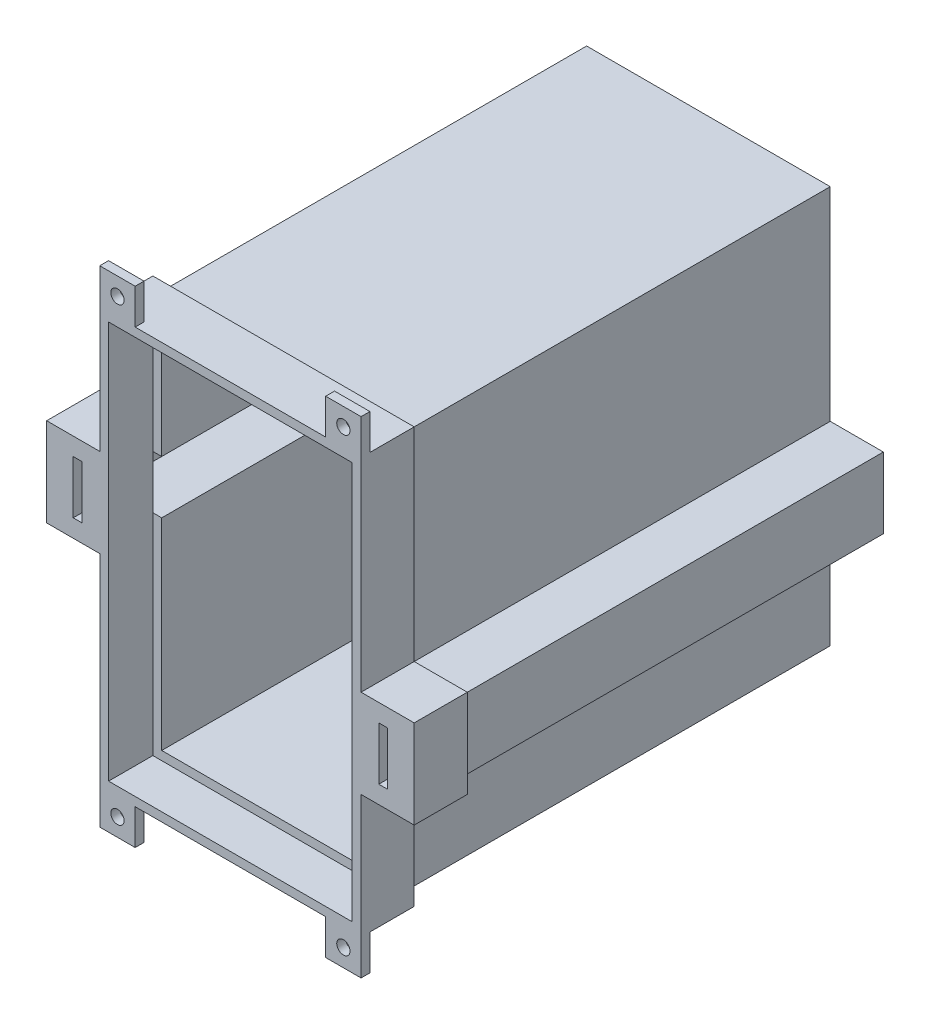
from build123d import *

# Parameters (mm, degrees)
BOSS_EXTRUDE1_DEPTH     = 155.575
SHELL1_T                = -3.175
SKETCH2_W               = 19.05
SKETCH2_H               = 72.263
SKETCH2_H_2             = 44.958
BOSS_EXTRUDE2_DEPTH     = 3.175
SKETCH5_W               = 90.551
SKETCH5_H               = 19.05
BOSS_EXTRUDE8_DEPTH     = 3.175
SKETCH7_W               = 19.05
SKETCH7_H               = 47.498
ALL_6_DEPTH             = 3.175
SKETCH8_W               = 19.05
SKETCH8_H               = 72.898
ALL_5_DEPTH             = 3.175
SKETCH9_W               = 93.726
SKETCH9_H               = 19.05
BOSS_EXTRUDE12_DEPTH    = 3.175
SKETCH10_W              = 15.875
SKETCH10_H              = 19.05
ALL2_DEPTH              = 3.175
SKETCH11_W              = 15.875
SKETCH11_H              = 19.05
ALL_7_DEPTH             = 3.175
SKETCH13_W              = 19.05
SKETCH13_H              = 25.4
ALL_2_DEPTH             = 3.175
SKETCH27_W              = 12.7
SKETCH27_H              = 3.175
BOSS_EXTRUDE29_DEPTH    = 12.7
SKETCH28_R              = 2.38125
CUT_EXTRUDE4_DEPTH      = 227.835119161
MIRROR2_COPY_1_SKETCH_W = 12.7
MIRROR2_COPY_1_SKETCH_H = 3.175
MIRROR2_COPY_1_DEPTH    = 12.7
MIRROR2_COPY_2_SKETCH_R = 2.38125
MIRROR2_COPY_2_DEPTH    = 227.835119161
SKETCH31_W              = 15.875
SKETCH31_H              = 22.225
BOSS_EXTRUDE31_DEPTH    = 3.175
SKETCH87_W              = 19.05
SKETCH87_H              = 31.75
ALL3_DEPTH              = 3.175
SKETCH91_W              = 15.875
SKETCH91_H              = 25.4
ALL_4_DEPTH             = 3.175
CUT_EXTRUDE24_DEPTH     = 201.654704914
SKETCH102_W             = 19.05
SKETCH102_H             = 19.05
BOSS_EXTRUDE58_DEPTH    = 3.175
SKETCH103_W             = 19.05
SKETCH103_H             = 19.05
BOSS_EXTRUDE59_DEPTH    = 3.175
SKETCH105_W             = 15.875
SKETCH105_H             = 25.4
BOSS_EXTRUDE65_DEPTH    = 9.525
SKETCH106_W             = 15.875
SKETCH106_H             = 25.4
BOSS_EXTRUDE66_DEPTH    = 9.525
SKETCH107_W             = 15.875
SKETCH107_H             = 25.4
BOSS_EXTRUDE67_DEPTH    = 6.35
SKETCH108_W             = 15.875
SKETCH108_H             = 25.4
BOSS_EXTRUDE68_DEPTH    = 6.35
SKETCH109_W             = 3.175
SKETCH109_H             = 15.875
BOSS_EXTRUDE69_DEPTH    = 3.175
SKETCH110_W             = 3.175
SKETCH110_H             = 15.875
BOSS_EXTRUDE70_DEPTH    = 3.175
SKETCH111_W             = 3.175
SKETCH111_H             = 15.875
BOSS_EXTRUDE71_DEPTH    = 3.175
SKETCH112_W             = 3.175
SKETCH112_H             = 15.875
BOSS_EXTRUDE72_DEPTH    = 3.175


with BuildPart() as part:
    # Sketch1 → Boss-Extrude1 (new body)
    with BuildSketch(Plane.XY):
        Polygon((-43.688, 71.3105), (43.688, 71.3105), (43.688, -1.5875), (62.738, -1.5875), (62.738, -26.9875), (43.688, -26.9875), (43.688, -71.3105), (-43.688, -71.3105), (-43.688, 0.9525), (-62.738, 0.9525), (-62.738, 26.3525), (-43.688, 26.3525), align=None)
    extrude(amount=-BOSS_EXTRUDE1_DEPTH)

    # Shell1
    shell1_openings = [part.faces().sort_by_distance(p)[0] for p in [
        (0, -0.022879475, 0),
    ]]
    offset(amount=SHELL1_T, openings=shell1_openings, kind=Kind.INTERSECTION)

    # Sketch2 → Boss-Extrude2 (add)
    with BuildSketch(Plane.ZY.offset(43.688)):
        with Locations((6.35, -35.179)):
            Rectangle(SKETCH2_W, SKETCH2_H)
        with Locations((6.35, 48.8315)):
            Rectangle(SKETCH2_W, SKETCH2_H_2)
    extrude(amount=BOSS_EXTRUDE2_DEPTH)

    # Sketch5 → Boss-Extrude8 (add)
    with BuildSketch(Plane.XZ.offset(71.3105)):
        with Locations((-1.5875, 6.35)):
            Rectangle(SKETCH5_W, SKETCH5_H)
    extrude(amount=BOSS_EXTRUDE8_DEPTH)

    # Sketch7 → ALL 6 (add)
    with BuildSketch(Plane(origin=(43.688, 0, 0), x_dir=(0, 0, -1), z_dir=(1, 0, 0))):
        with Locations((-6.35, -50.7365)):
            Rectangle(SKETCH7_W, SKETCH7_H)
    extrude(amount=ALL_6_DEPTH)

    # Sketch8 → ALL 5 (add)
    with BuildSketch(Plane(origin=(43.688, 0, 0), x_dir=(0, 0, -1), z_dir=(1, 0, 0))):
        with Locations((-6.35, 34.8615)):
            Rectangle(SKETCH8_W, SKETCH8_H)
    extrude(amount=ALL_5_DEPTH)

    # Sketch9 → Boss-Extrude12 (add)
    with BuildSketch(Plane(origin=(0, 71.3105, 0), x_dir=(1, 0, 0), z_dir=(0, 1, 0))):
        with Locations((0, -6.35)):
            Rectangle(SKETCH9_W, SKETCH9_H)
    extrude(amount=BOSS_EXTRUDE12_DEPTH)

    # Sketch10 → ALL2 (add)
    with BuildSketch(Plane(origin=(0, -1.5875, 0), x_dir=(1, 0, 0), z_dir=(0, 1, 0))):
        with Locations((54.8005, -6.35)):
            Rectangle(SKETCH10_W, SKETCH10_H)
    extrude(amount=ALL2_DEPTH)

    # Sketch11 → ALL 7 (add)
    with BuildSketch(Plane.XZ.offset(26.9875)):
        with Locations((54.8005, 6.35)):
            Rectangle(SKETCH11_W, SKETCH11_H)
    extrude(amount=ALL_7_DEPTH)

    # Sketch13 → ALL 2 (add)
    with BuildSketch(Plane.ZY.offset(62.738)):
        with Locations((6.35, 13.6525)):
            Rectangle(SKETCH13_W, SKETCH13_H)
    extrude(amount=ALL_2_DEPTH)

    # Sketch27 → Boss-Extrude29 (add)
    with BuildSketch(Plane(origin=(0, 74.4855, -58.6105), x_dir=(1, 0, 0), z_dir=(0, -1, 0))):
        with Locations((40.513, 72.898)):
            Rectangle(SKETCH27_W, SKETCH27_H)
    boss_extrude29 = extrude(amount=-BOSS_EXTRUDE29_DEPTH)

    # Sketch28 → Cut-Extrude4 (cut, through all)
    with BuildSketch(Plane(origin=(0, 58.6105, 15.875), x_dir=(1, 0, 0), z_dir=(0, 0, -1))):
        with Locations(Location((40.513, -22.225, 0), (0, 0, 180))):
            Circle(SKETCH28_R)
    cut_extrude4 = extrude(amount=CUT_EXTRUDE4_DEPTH, mode=Mode.SUBTRACT)

    # Mirror1: Boss-Extrude29, Cut-Extrude4 across plane
    add(boss_extrude29.mirror(Plane(origin=(0, 0, 0), x_dir=(0, 0, 1), z_dir=(1, 0, 0))))
    add(cut_extrude4.mirror(Plane(origin=(0, 0, 0), x_dir=(0, 0, 1), z_dir=(1, 0, 0))), mode=Mode.SUBTRACT)

    # Mirror2: Boss-Extrude29, Cut-Extrude4 across plane
    add(boss_extrude29.mirror(Plane.ZX))
    add(cut_extrude4.mirror(Plane.ZX), mode=Mode.SUBTRACT)

    # Mirror2 copy 1 sketch → Mirror2 copy 1 (add)
    with BuildSketch(Plane(origin=(0, -74.4855, -58.6105), x_dir=(-1, 0, 0), z_dir=(0, 1, 0))):
        with Locations((40.513, 72.898)):
            Rectangle(MIRROR2_COPY_1_SKETCH_W, MIRROR2_COPY_1_SKETCH_H)
    extrude(amount=-MIRROR2_COPY_1_DEPTH)

    # Mirror2 copy 2 sketch → Mirror2 copy 2 (cut, through all)
    with BuildSketch(Plane(origin=(0, -58.6105, 15.875), x_dir=(-1, 0, 0), z_dir=(0, 0, -1))):
        with Locations(Location((40.513, -22.225, 0), (0, 0, 180))):
            Circle(MIRROR2_COPY_2_SKETCH_R)
    extrude(amount=MIRROR2_COPY_2_DEPTH, mode=Mode.SUBTRACT)

    # Sketch31 → Boss-Extrude31 (add)
    with BuildSketch(Plane(origin=(-62.738, 0, 0), x_dir=(0, 0, -1), z_dir=(1, 0, 0))):
        with Locations((-7.9375, 15.24)):
            Rectangle(SKETCH31_W, SKETCH31_H)
    extrude(amount=BOSS_EXTRUDE31_DEPTH)

    # Sketch87 → ALL3 (add)
    with BuildSketch(Plane(origin=(62.738, 0, 0), x_dir=(0, 0, -1), z_dir=(1, 0, 0))):
        with Locations((-6.35, -14.2875)):
            Rectangle(SKETCH87_W, SKETCH87_H)
    extrude(amount=ALL3_DEPTH)

    # Sketch91 → ALL 4 (cut)
    with BuildSketch(Plane(origin=(-59.563, 0, 0), x_dir=(0, 0, -1), z_dir=(1, 0, 0))):
        with Locations((-7.9375, 13.6525)):
            Rectangle(SKETCH91_W, SKETCH91_H)
    extrude(amount=-ALL_4_DEPTH, mode=Mode.SUBTRACT)

    # Sketch101 → Cut-Extrude24 (cut, through all)
    with BuildSketch(Plane.XY.offset(-152.4)):
        Polygon((-40.513, -68.1355), (40.513, -68.1355), (40.513, -23.8125), (59.563, -23.8125), (59.563, -4.7625), (40.513, -4.7625), (40.513, 68.1355), (-40.513, 68.1355), (-40.513, 23.1775), (-59.563, 23.1775), (-59.563, 4.1275), (-40.513, 4.1275), align=None)
    extrude(amount=-CUT_EXTRUDE24_DEPTH, mode=Mode.SUBTRACT)

    # Sketch102 → Boss-Extrude58 (add)
    with BuildSketch(Plane(origin=(0, 26.3525, 0), x_dir=(1, 0, 0), z_dir=(0, 1, 0))):
        with Locations((-56.388, -6.35)):
            Rectangle(SKETCH102_W, SKETCH102_H)
    extrude(amount=BOSS_EXTRUDE58_DEPTH)

    # Sketch103 → Boss-Extrude59 (add)
    with BuildSketch(Plane.XZ.offset(-0.9525)):
        with Locations((-56.388, 6.35)):
            Rectangle(SKETCH103_W, SKETCH103_H)
    extrude(amount=BOSS_EXTRUDE59_DEPTH)

    # Sketch105 → Boss-Extrude65 (add)
    with BuildSketch(Plane(origin=(-43.688, 0, 0), x_dir=(0, 0, -1), z_dir=(1, 0, 0))):
        with Locations((-7.9375, 13.6525)):
            Rectangle(SKETCH105_W, SKETCH105_H)
    extrude(amount=-BOSS_EXTRUDE65_DEPTH)

    # Sketch106 → Boss-Extrude66 (add)
    with BuildSketch(Plane.ZY.offset(-43.688)):
        with Locations((7.9375, -14.2875)):
            Rectangle(SKETCH106_W, SKETCH106_H)
    extrude(amount=-BOSS_EXTRUDE66_DEPTH)

    # Sketch107 → Boss-Extrude67 (add)
    with BuildSketch(Plane.ZY.offset(-62.738)):
        with Locations((7.9375, -14.2875)):
            Rectangle(SKETCH107_W, SKETCH107_H)
    extrude(amount=BOSS_EXTRUDE67_DEPTH)

    # Sketch108 → Boss-Extrude68 (add)
    with BuildSketch(Plane(origin=(-62.738, 0, 0), x_dir=(0, 0, -1), z_dir=(1, 0, 0))):
        with Locations((-7.9375, 13.6525)):
            Rectangle(SKETCH108_W, SKETCH108_H)
    extrude(amount=BOSS_EXTRUDE68_DEPTH)

    # Sketch109 → Boss-Extrude69 (add)
    with BuildSketch(Plane(origin=(0, 0.9525, 0), x_dir=(1, 0, 0), z_dir=(0, 1, 0))):
        with Locations((-54.8005, -7.9375)):
            Rectangle(SKETCH109_W, SKETCH109_H)
    extrude(amount=BOSS_EXTRUDE69_DEPTH)

    # Sketch110 → Boss-Extrude70 (add)
    with BuildSketch(Plane.XZ.offset(-26.3525)):
        with Locations((-54.8005, 7.9375)):
            Rectangle(SKETCH110_W, SKETCH110_H)
    extrude(amount=BOSS_EXTRUDE70_DEPTH)

    # Sketch111 → Boss-Extrude71 (add)
    with BuildSketch(Plane.XZ.offset(1.5875)):
        with Locations((54.8005, 7.9375)):
            Rectangle(SKETCH111_W, SKETCH111_H)
    extrude(amount=BOSS_EXTRUDE71_DEPTH)

    # Sketch112 → Boss-Extrude72 (add)
    with BuildSketch(Plane(origin=(0, -26.9875, 0), x_dir=(1, 0, 0), z_dir=(0, 1, 0))):
        with Locations((54.8005, -7.9375)):
            Rectangle(SKETCH112_W, SKETCH112_H)
    extrude(amount=BOSS_EXTRUDE72_DEPTH)


solid = part.part
